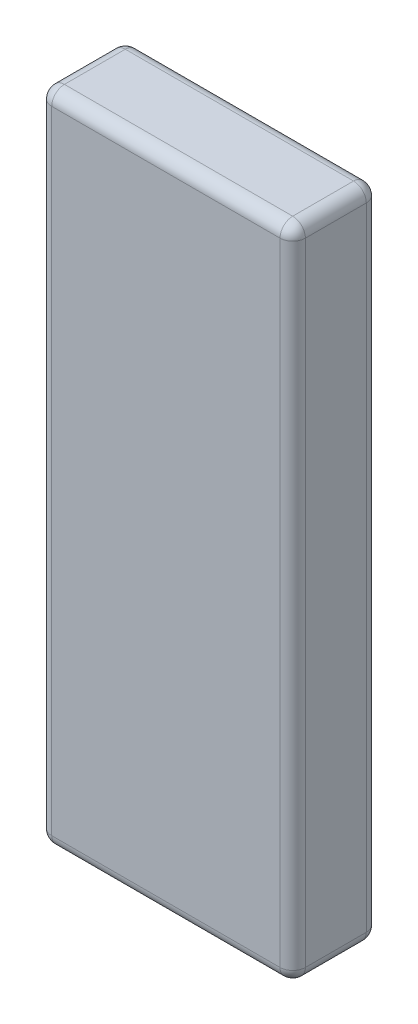
from build123d import *

# Parameters (mm, degrees)
SKETCH_1_W      = 20
SKETCH_1_H      = 51.8
EXTRUDE_1_DEPTH = 6.8
FILLET_1_R      = 1


with BuildPart() as part:
    # Эскиз1 → Бобышка-Вытянуть1 (new body)
    with BuildSketch(Plane.XY):
        with Locations((10, 25.9)):
            Rectangle(SKETCH_1_W, SKETCH_1_H)
    extrude(amount=EXTRUDE_1_DEPTH)

    # Скругление1
    fillet_1_edges = [part.edges().sort_by_distance(p)[0] for p in [
        (20, 25.9, 6.8),
        (10, 51.8, 6.8),
        (0, 25.9, 6.8),
        (10, 51.8, 0),
        (20, 25.9, 0),
        (10, 0, 0),
        (0, 25.9, 0),
        (0, 51.8, 3.4),
        (20, 51.8, 3.4),
        (20, 0, 3.4),
        (0, 0, 3.4),
        (10, 0, 6.8),
    ]]
    fillet(fillet_1_edges, radius=FILLET_1_R)


solid = part.part
